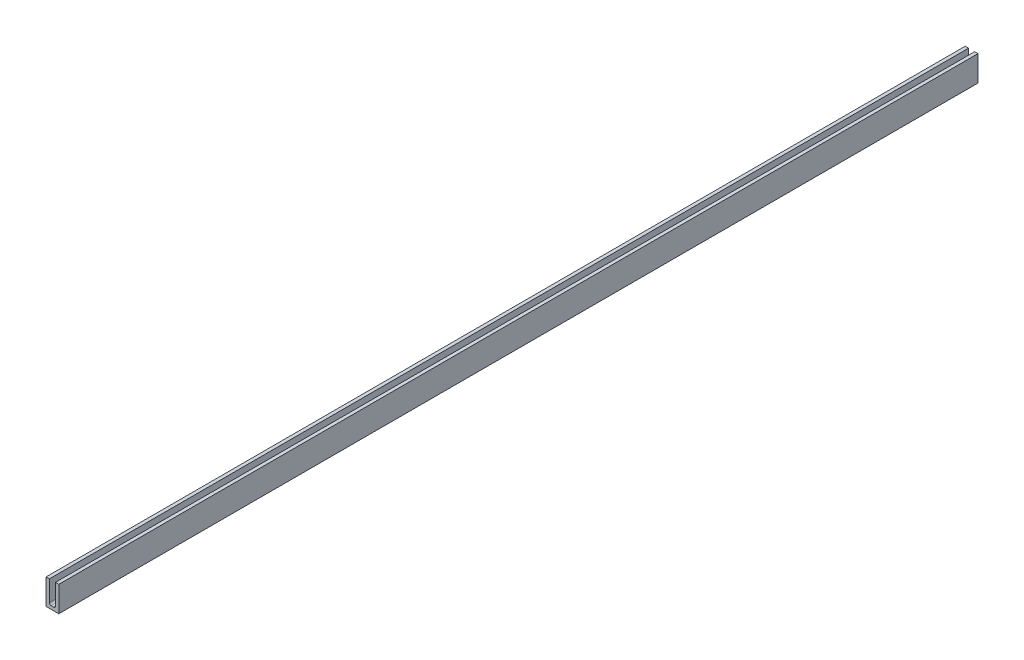
from build123d import *

# Parameters (mm, degrees)
BOSS_EXTRUDE1_DEPTH = 457.2
FILLET1_R           = 1.651


with BuildPart() as part:
    # Sketch3 → Boss-Extrude1 (new, symmetric)
    with BuildSketch(Plane.XY):
        Polygon((-6.35, 12.7), (-6.35, -12.7), (6.35, -12.7), (6.35, 12.7), (3.048, 12.7), (3.048, -9.398), (-3.048, -9.398), (-3.048, 12.7), align=None)
    extrude(amount=BOSS_EXTRUDE1_DEPTH, both=True)

    # Fillet1
    fillet1_edges = [part.edges().sort_by_distance(p)[0] for p in [
        (-3.048, -9.398, 0),
        (3.048, -9.398, 0),
    ]]
    fillet(fillet1_edges, radius=FILLET1_R)


solid = part.part
